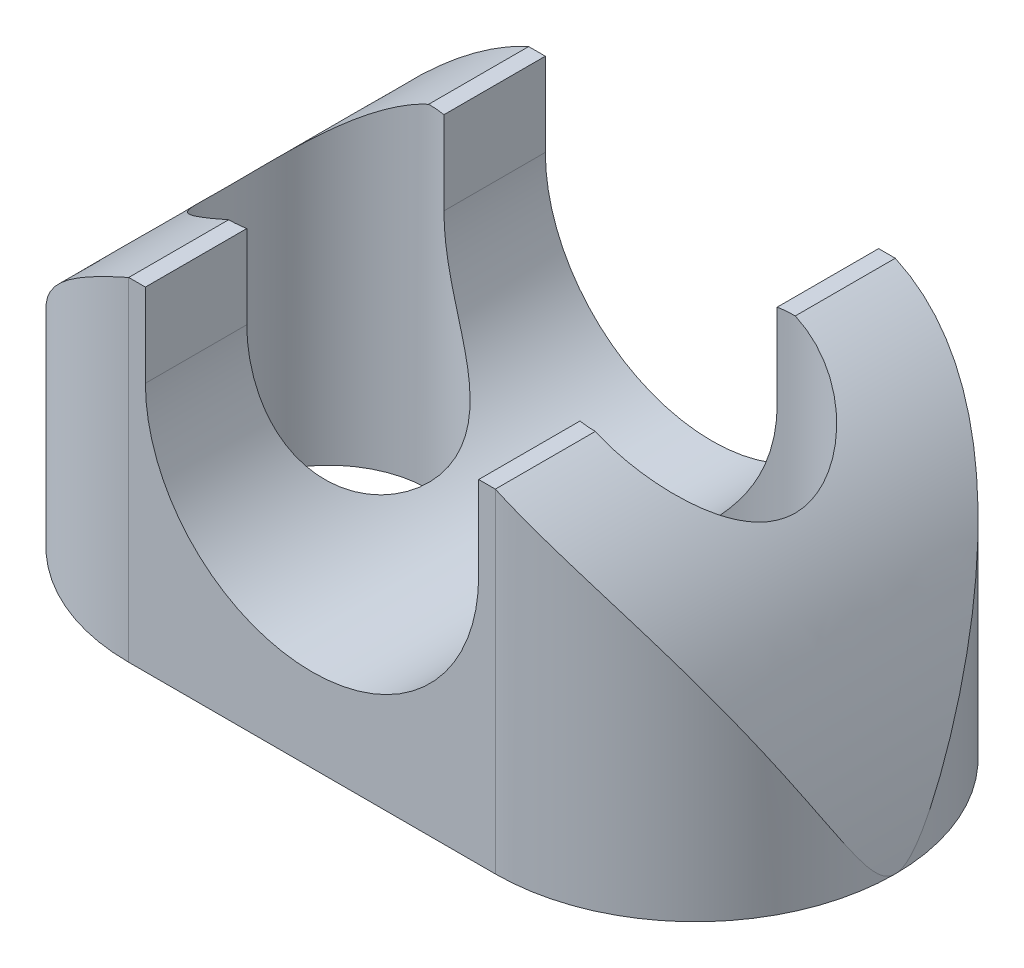
from build123d import *

# Parameters (mm, degrees)
ESBO_O1_R                = 3
RESSALTO_EXTRUS_O1_DEPTH = 10
CORTE_EXTRUS_O1_DEPTH    = 20.397164741
CORTE_EXTRUS_O2_DEPTH    = 20.397164855


with BuildPart() as part:
    # Esboço1 → Ressalto-extrusão1 (new body)
    with BuildSketch(Plane(origin=(0, 0, 0), x_dir=(1, 0, 0), z_dir=(0, 1, 0))):
        with BuildLine():
            Line((-5.5, -6), (5.5, -6))
            ThreePointArc((5.5, -6), (11.5, 0), (5.5, 6))
            Line((5.5, 6), (-5.5, 6))
            ThreePointArc((-5.5, 6), (-11.5, 0), (-5.5, -6))
        make_face()
        with Locations(Location((-5.5, 0, 0), (0, 0, 270))):
            Circle(ESBO_O1_R, mode=Mode.SUBTRACT)
        with Locations(Location((5.5, 0, 0), (0, 0, 270))):
            Circle(ESBO_O1_R, mode=Mode.SUBTRACT)
    extrude(amount=RESSALTO_EXTRUS_O1_DEPTH)

    # Esboço2 → Corte-extrusão1 (cut, through all)
    with BuildSketch(Plane.XY.offset(6)):
        with BuildLine():
            Line((-5, 7.5), (-5, 10))
            Line((-5, 10), (5, 10))
            Line((5, 10), (5, 7.5))
            ThreePointArc((5, 7.5), (0, 2.5), (-5, 7.5))
        make_face()
    extrude(amount=-CORTE_EXTRUS_O1_DEPTH, mode=Mode.SUBTRACT)

    # Esboço3 → Corte-extrusão2 (cut, through all)
    with BuildSketch(Plane.XY.offset(6)):
        with BuildLine():
            Line((-11.5, 10), (-11.5, 0))
            add(Edge.make_bspline(
                [(-11.5, 0), (-10.890573495, 7.573019438), (-5.5, 10)],
                knots=[0, 0, 0, 0.339761367, 0.339761367, 0.339761367], degree=2))
            Line((-5.5, 10), (-11.5, 10))
        make_face()
        with BuildLine():
            Line((11.5, 10), (5.5, 10))
            add(Edge.make_bspline(
                [(5.5, 10), (10.890573495, 7.573019438), (11.5, 0)],
                knots=[0.660238633, 0.660238633, 0.660238633, 1, 1, 1], degree=2))
            Line((11.5, 0), (11.5, 10))
        make_face()
    extrude(amount=-CORTE_EXTRUS_O2_DEPTH, mode=Mode.SUBTRACT)


solid = part.part
